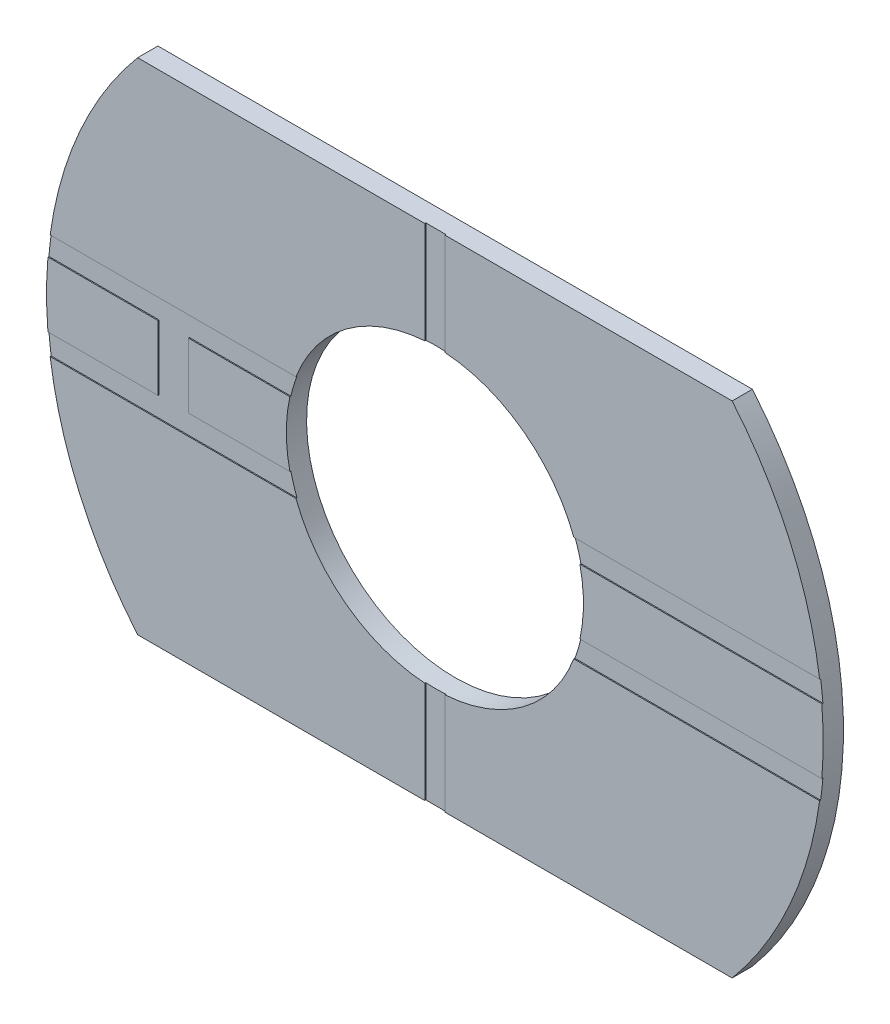
from build123d import *

# Parameters (mm, degrees)
SKETCH_1_R          = 57.5
SKETCH_1_R_2        = 22
EXTRUDE_1_DEPTH     = 3
SKETCH_2_W          = 140.517246729
SKETCH_2_H          = 54.837850232
SKETCH_2_H_2        = 57.45712313
CUT_EXTRUDE_1_DEPTH = 82.372599811
SKETCH_3_W          = 35
SKETCH_3_H          = 9.6
CUT_EXTRUDE_2_DEPTH = 0.15


with BuildPart() as part:
    # Эскиз1 → Бобышка-Вытянуть1 (new body)
    with BuildSketch(Plane.XY):
        Circle(SKETCH_1_R)
        Circle(SKETCH_1_R_2, mode=Mode.SUBTRACT)
    extrude(amount=EXTRUDE_1_DEPTH)

    # Эскиз2 → Вырез-Вытянуть1 (cut, through all)
    with BuildSketch(Plane.XY.offset(3)):
        with Locations((-1.418485275, 64.418925116)):
            Rectangle(SKETCH_2_W, SKETCH_2_H)
        with Locations((-1.418485275, -65.728561565)):
            Rectangle(SKETCH_2_W, SKETCH_2_H_2)
    extrude(amount=-CUT_EXTRUDE_1_DEPTH, mode=Mode.SUBTRACT)

    # Эскиз3 → Вырез-Вытянуть2 (cut)
    with BuildSketch(Plane.XY.offset(3)):
        Polygon((-1.5, 37), (1.5, 37), (1.5, 7.8), (63.743793757, 7.8), (63.743793757, 4.8), (1.5, 4.8), (1.5, -4.8), (65.582153435, -4.8), (65.582153435, -7.8), (1.5, -7.8), (1.5, -37), (-1.5, -37), (-1.5, -7.8), (-73.634100968, -7.8), (-73.634100968, -4.8), (-41, -4.8), (-41, 4.8), (-72.371033765, 4.8), (-72.371033765, 7.8), (-1.5, 7.8), align=None)
        with Locations((-19, 0)):
            Rectangle(SKETCH_3_W, SKETCH_3_H, mode=Mode.SUBTRACT)
    extrude(amount=-CUT_EXTRUDE_2_DEPTH, mode=Mode.SUBTRACT)


solid = part.part
